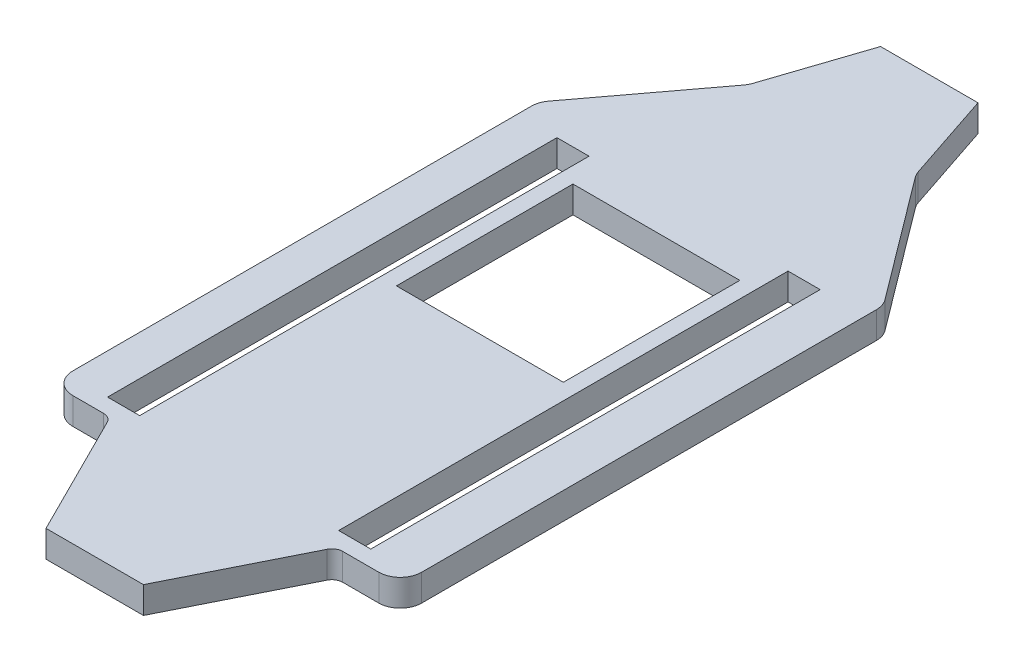
from build123d import *

# Parameters (mm, degrees)
SKETCH1_W           = 1.5
SKETCH1_H           = 21
SKETCH1_W_2         = 7.8
SKETCH1_H_2         = 8.247795839
BOSS_EXTRUDE1_DEPTH = 1.25


with BuildPart() as part:
    # Sketch1 → Boss-Extrude1 (new body)
    with BuildSketch(Plane(origin=(0, 0, 0), x_dir=(1, 0, 0), z_dir=(0, 1, 0))):
        with BuildLine():
            Line((0, 1), (0, 22.252194503))
            ThreePointArc((0, 22.252194503), (-0.051316702, 22.568422269), (-0.2, 22.852194503))
            Line((-0.2, 22.852194503), (-4.453950106, 28.524127978))
            ThreePointArc((-4.453950106, 28.524127978), (-4.539729418, 28.660021298), (-4.602633404, 28.807900212))
            Line((-4.602633404, 28.807900212), (-6, 33))
            Line((-6, 33), (-10.554092553, 33))
            Line((-10.554092553, 33), (-12.046049894, 28.524127978))
            ThreePointArc((-12.046049894, 28.524127978), (-12.10895388, 28.376249064), (-12.194733192, 28.240355744))
            Line((-12.194733192, 28.240355744), (-16.1, 23.033333333))
            ThreePointArc((-16.1, 23.033333333), (-16.248683298, 22.749561099), (-16.3, 22.433333333))
            Line((-16.3, 22.433333333), (-16.3, 1))
            ThreePointArc((-16.3, 1), (-16.007106781, 0.292893219), (-15.3, 0))
            Line((-15.3, 0), (-13.863109548, 0))
            ThreePointArc((-13.863109548, 0), (-13.600243992, -0.074674596), (-13.415895952, -0.276393202))
            Line((-13.415895952, -0.276393202), (-10.554092553, -6))
            Line((-10.554092553, -6), (-6, -6))
            Line((-6, -6), (-3.138196601, -0.276393202))
            ThreePointArc((-3.138196601, -0.276393202), (-2.953848562, -0.074674596), (-2.690983006, 0))
            Line((-2.690983006, 0), (-1, 0))
            ThreePointArc((-1, 0), (-0.292893219, 0.292893219), (0, 1))
        make_face()
        with Locations((-13.677046277, 11.25)):
            Rectangle(SKETCH1_W, SKETCH1_H, mode=Mode.SUBTRACT)
        with Locations((-2.877046277, 11.25)):
            Rectangle(SKETCH1_W, SKETCH1_H, mode=Mode.SUBTRACT)
        with Locations((-8.277046277, 16.12389792)):
            Rectangle(SKETCH1_W_2, SKETCH1_H_2, mode=Mode.SUBTRACT)
    extrude(amount=BOSS_EXTRUDE1_DEPTH)


solid = part.part
